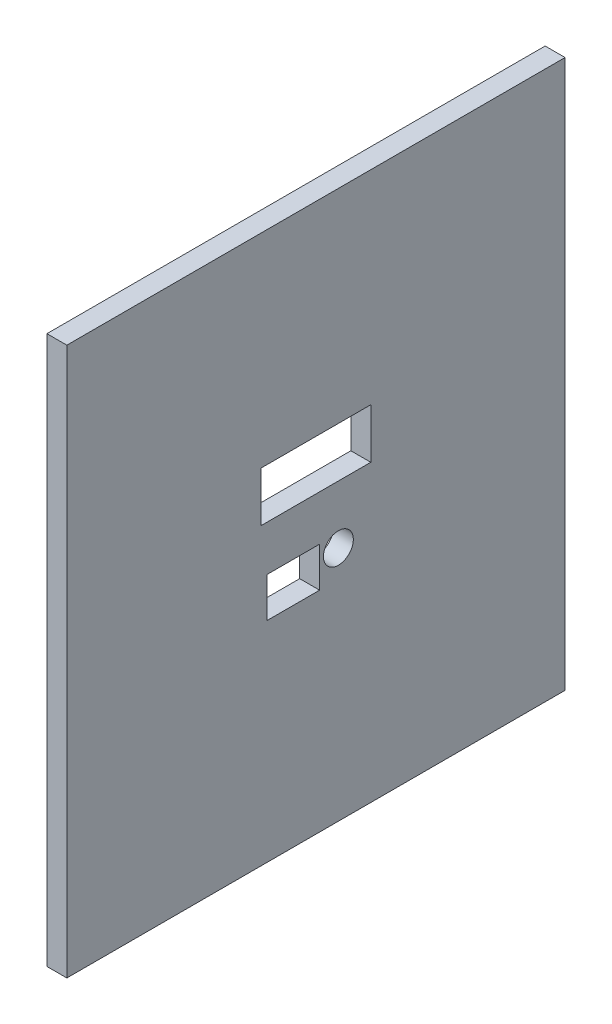
from build123d import *

# Parameters (mm, degrees)
SKETCH1_W           = 50
SKETCH1_H           = 55
BOSS_EXTRUDE1_DEPTH = 2
SKETCH2_W           = 5.3
SKETCH2_H           = 4
SKETCH2_R           = 1.5
SKETCH2_W_2         = 10.5
SKETCH2_H_2         = 4.678571429
CUT_EXTRUDE1_DEPTH  = 10


with BuildPart() as part:
    # Sketch1 → Boss-Extrude1 (new body)
    with BuildSketch(Plane(origin=(0, 0, 0), x_dir=(0, 0, -1), z_dir=(1, 0, 0))):
        Rectangle(SKETCH1_W, SKETCH1_H)
    extrude(amount=BOSS_EXTRUDE1_DEPTH)

    # Sketch2 → Cut-Extrude1 (cut)
    with BuildSketch(Plane(origin=(2, 0, 0), x_dir=(0, 0, -1), z_dir=(1, 0, 0))):
        with Locations((-2.284317843, -4.476763319)):
            Rectangle(SKETCH2_W, SKETCH2_H)
        with Locations((2.25, -3.75)):
            Circle(SKETCH2_R)
        Polygon((5.25, 6.75), (5.25, 2.071428571), (5.5, 2.071428571), (5.5, 7.071428571), (-5.5, 7.071428571), (-5.5, 2.071428571), (-5.25, 2.071428571), (-5.25, 6.75), align=None)
        with Locations((0, 4.410714286)):
            Rectangle(SKETCH2_W_2, SKETCH2_H_2)
    extrude(amount=-CUT_EXTRUDE1_DEPTH, mode=Mode.SUBTRACT)


solid = part.part
